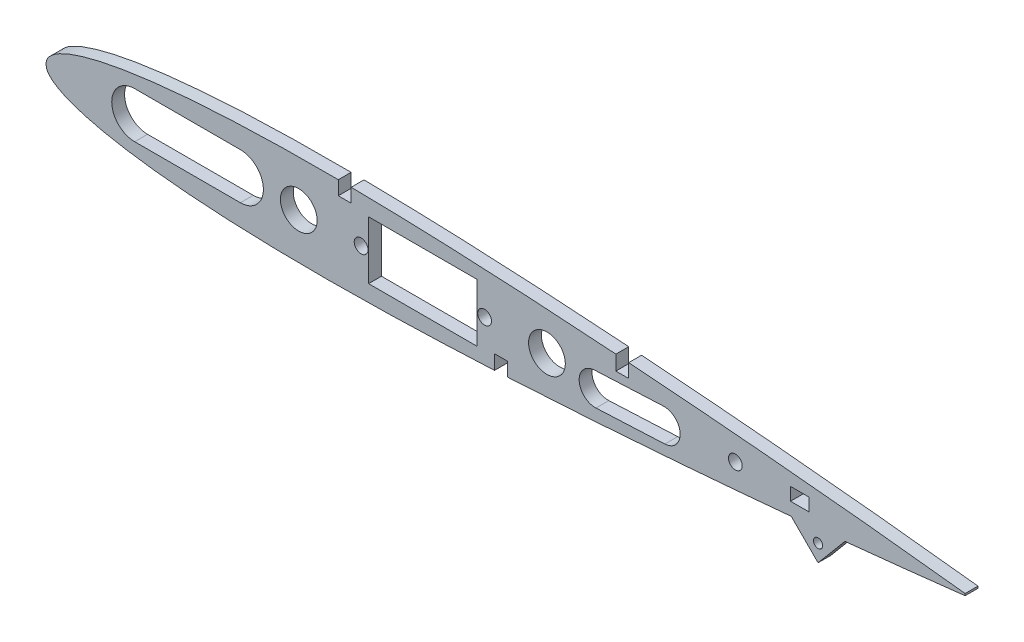
from build123d import *

# Parameters (mm, degrees)
SKETCH_3_R      = 4
SKETCH_3_R_2    = 1.5
SKETCH_3_R_3    = 1
SKETCH_3_W      = 23.6
SKETCH_3_H      = 12.6
SKETCH_3_W_2    = 4
SKETCH_3_H_2    = 2.8
EXTRUDE_3_DEPTH = 2.8


with BuildPart() as part:
    # Эскиз3 → Бобышка-Вытянуть3 (new body)
    with BuildSketch(Plane.XY):
        with BuildLine():
            Line((200, 0.21), (200, -0.21))
            add(Edge.make_bspline(
                [(173.839461144, -3.040801203), (175.943333039, -2.830170954), (179.564023078, -2.461029339), (184.58704572, -1.932479181), (188.771568451, -1.480695182), (192.530784687, -1.065063842), (195.747560944, -0.701689979), (198.179524953, -0.422303954), (199.520051416, -0.265971644), (200, -0.21)],
                knots=[0.870307302, 0.870307302, 0.870307302, 0.870307302, 0.901571134, 0.924121062, 0.944988816, 0.963803939, 0.980044339, 0.992855276, 1, 1, 1, 1], degree=3))
            Line((173.839461144, -3.040801203), (168, -10))
            Line((168, -10), (162.170244806, -4.170244806))
            add(Edge.make_bspline(
                [(100.4, -8.802264), (100.782530515, -8.78200637), (103.102887785, -8.657921344), (107.374551667, -8.416266925), (113.223109349, -8.057497647), (119.097620698, -7.671146294), (124.98256269, -7.259840679), (130.861479372, -6.826169971), (136.716836604, -6.372892076), (142.52985565, -5.902766003), (148.280267017, -5.418602057), (153.94609331, -4.923426646), (158.566687276, -4.50520567), (161.295968592, -4.251994411), (162.170244806, -4.170244806)],
                knots=[0.507199784, 0.507199784, 0.507199784, 0.507199784, 0.512863887, 0.541558094, 0.570462313, 0.599504248, 0.628607349, 0.657690446, 0.686667237, 0.715444849, 0.743923546, 0.77199483, 0.799540253, 0.812523886, 0.812523886, 0.812523886, 0.812523886], degree=3))
            Line((100.4, -8.802264), (100.4, -5.802264))
            Line((100.4, -5.802264), (97.6, -5.802264))
            Line((97.6, -5.802264), (97.6, -8.946938935))
            add(Edge.make_bspline(
                [(0, 0), (0.032444913, -0.278495812), (0.100633198, -0.863800259), (0.62379252, -1.678905598), (1.407454518, -2.445359098), (2.48215991, -3.178007515), (3.831515725, -3.88154028), (5.45639967, -4.556541724), (7.350195056, -5.201638101), (9.507426038, -5.81478546), (11.921305119, -6.393879384), (14.58489291, -6.936612431), (17.490877441, -7.44078362), (20.631718928, -7.904294519), (23.999672572, -8.325205071), (27.586779877, -8.701741845), (31.384869897, -9.032475932), (35.385580653, -9.316092874), (39.580313292, -9.551735955), (43.960263434, -9.738807032), (48.51637403, -9.877065972), (53.239340889, -9.96650448), (58.119580475, -10.007674079), (63.147232299, -10.001179647), (68.312112852, -9.948180779), (73.603706202, -9.849984193), (79.011121778, -9.708185508), (84.52309051, -9.524657051), (90.127882502, -9.301433286), (94.497039971, -9.101072496), (96.996632606, -8.97732649), (97.6, -8.946938935)],
                knots=[0, 0, 0, 0, 0.004099011, 0.008614742, 0.013934855, 0.020277775, 0.027752981, 0.036410215, 0.046266433, 0.057320238, 0.069558946, 0.082962861, 0.097507218, 0.113164082, 0.12990269, 0.147690304, 0.166492185, 0.186271967, 0.206991861, 0.228612215, 0.251092165, 0.274388983, 0.298458209, 0.323253842, 0.348727971, 0.374830387, 0.40150919, 0.428710016, 0.456376154, 0.484448083, 0.493380908, 0.493380908, 0.493380908, 0.493380908], degree=3))
            add(Edge.make_bspline(
                [(63.6, 9.990751447), (63.433767139, 9.991846739), (61.590618822, 10.003190391), (58.119580475, 10.007674079), (53.239340889, 9.96650448), (48.51637403, 9.877065972), (43.960263434, 9.738807032), (39.580313292, 9.551735955), (35.385580653, 9.316092874), (31.384869897, 9.032475932), (27.586779877, 8.701741845), (23.999672572, 8.325205071), (20.631718928, 7.904294519), (17.490877441, 7.44078362), (14.58489291, 6.936612431), (11.921305119, 6.393879384), (9.507426038, 5.81478546), (7.350195056, 5.201638101), (5.45639967, 4.556541724), (3.831515725, 3.88154028), (2.48215991, 3.178007515), (1.407454518, 2.445359098), (0.62379252, 1.678905598), (0.100633198, 0.863800259), (0.032444913, 0.278495812), (0, 0)],
                knots=[0.674288155, 0.674288155, 0.674288155, 0.674288155, 0.676746158, 0.701541791, 0.725611017, 0.748907835, 0.771387785, 0.793008139, 0.813728033, 0.833507815, 0.852309696, 0.87009731, 0.886835918, 0.902492782, 0.917037139, 0.930441054, 0.942679762, 0.953733567, 0.963589785, 0.972247019, 0.979722225, 0.986065145, 0.991385258, 0.995900989, 1, 1, 1, 1], degree=3))
            Line((63.6, 9.990751447), (63.6, 6.965595937))
            Line((63.6, 6.965595937), (66.4, 6.965595937))
            Line((66.4, 6.965595937), (66.4, 9.965595937))
            add(Edge.make_bspline(
                [(124, 7.326294797), (122.364596134, 7.442700413), (118.769611386, 7.692718614), (113.223109349, 8.057497647), (107.374551667, 8.416266925), (101.566628903, 8.744829808), (95.813307617, 9.040711105), (90.127882502, 9.301433286), (84.52309051, 9.524657051), (79.011121778, 9.708185508), (73.603706202, 9.849984193), (69.41154014, 9.927778606), (67.023185068, 9.958531818), (66.4, 9.965595937)],
                knots=[0.376253135, 0.376253135, 0.376253135, 0.376253135, 0.400495752, 0.429537687, 0.458441906, 0.487136113, 0.515551917, 0.543623846, 0.571289984, 0.59849081, 0.625169613, 0.651272029, 0.660487149, 0.660487149, 0.660487149, 0.660487149], degree=3))
            Line((124, 7.326294797), (124, 4.124412105))
            Line((124, 4.124412105), (126.8, 4.124412105))
            Line((126.8, 4.124412105), (126.8, 7.124412105))
            add(Edge.make_bspline(
                [(200, 0.21), (199.520051416, 0.265971644), (198.179524953, 0.422303954), (195.747560944, 0.701689979), (192.530784687, 1.065063842), (188.771568451, 1.480695182), (184.58704572, 1.932479181), (180.05616868, 2.409243063), (175.238405485, 2.90257428), (168.371896377, 3.585728287), (161.260104983, 4.261418012), (153.94609331, 4.923426646), (148.280267017, 5.418602057), (142.52985565, 5.902766003), (136.716836604, 6.372892076), (131.466708661, 6.779317653), (128.156255998, 7.025385403), (126.8, 7.124412105)],
                knots=[0, 0, 0, 0, 0.007144724, 0.019955661, 0.036196061, 0.055011184, 0.075878938, 0.098428866, 0.122375554, 0.147487885, 0.200459747, 0.22800517, 0.256076454, 0.284555151, 0.313332763, 0.342309554, 0.362416837, 0.362416837, 0.362416837, 0.362416837], degree=3))
        make_face()
        with Locations((109, 0)):
            Circle(SKETCH_3_R, mode=Mode.SUBTRACT)
        with Locations((55, 0)):
            Circle(SKETCH_3_R, mode=Mode.SUBTRACT)
        with Locations((150, 0)):
            Circle(SKETCH_3_R_2, mode=Mode.SUBTRACT)
        with Locations((68.565, 0)):
            Circle(SKETCH_3_R_2, mode=Mode.SUBTRACT)
        with Locations((95.435, 0)):
            Circle(SKETCH_3_R_2, mode=Mode.SUBTRACT)
        with Locations((168, -6.3)):
            Circle(SKETCH_3_R_3, mode=Mode.SUBTRACT)
        with BuildLine():
            Line((19.3, 5), (42.3, 5))
            ThreePointArc((42.3, 5), (47.3, 0), (42.3, -5))
            Line((42.3, -5), (19.3, -5))
            ThreePointArc((19.3, -5), (14.3, 0), (19.3, 5))
        make_face(mode=Mode.SUBTRACT)
        with BuildLine():
            Line((119.34345336, 1.992816182), (134.326801485, 2.699412943))
            ThreePointArc((134.326801485, 2.699412943), (137.987788625, -0.631829042), (134.65654664, -4.292816182))
            Line((134.65654664, -4.292816182), (119.673198515, -4.999412943))
            ThreePointArc((119.673198515, -4.999412943), (116.012211375, -1.668170958), (119.34345336, 1.992816182))
        make_face(mode=Mode.SUBTRACT)
        with Locations((82, 0)):
            Rectangle(SKETCH_3_W, SKETCH_3_H, mode=Mode.SUBTRACT)
        with Locations((164, 0)):
            Rectangle(SKETCH_3_W_2, SKETCH_3_H_2, mode=Mode.SUBTRACT)
    extrude(amount=EXTRUDE_3_DEPTH)


solid = part.part
